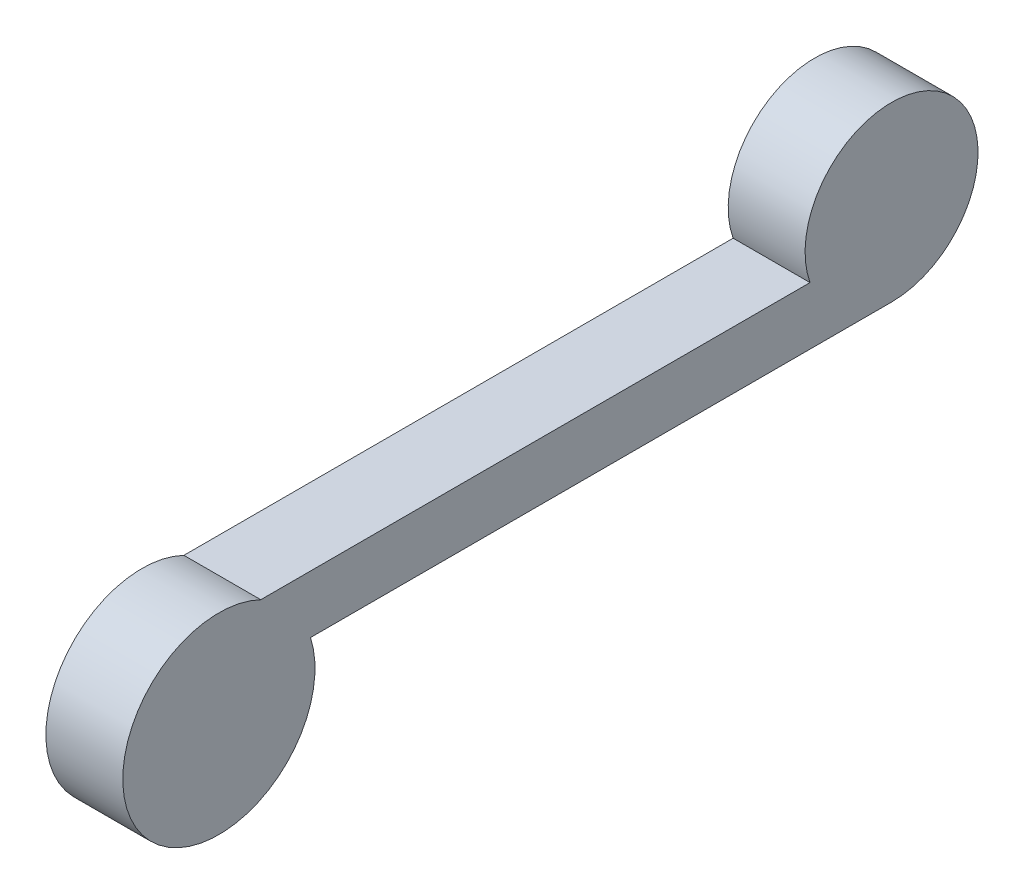
from build123d import *

# Parameters (mm, degrees)
SKETCH1_R           = 50
SKETCH1_R_2         = 45
SKETCH1_W           = 350
SKETCH1_H           = 30
BOSS_EXTRUDE1_DEPTH = 20


with BuildPart() as part:
    # Sketch1 → Boss-Extrude1 (new, symmetric)
    with BuildSketch(Plane(origin=(0, 0, 0), x_dir=(0, 0, -1), z_dir=(1, 0, 0))):
        Circle(SKETCH1_R)
        with Locations((350, 60)):
            Circle(SKETCH1_R_2)
        with Locations((175, 30)):
            Rectangle(SKETCH1_W, SKETCH1_H)
    extrude(amount=BOSS_EXTRUDE1_DEPTH, both=True)


solid = part.part
